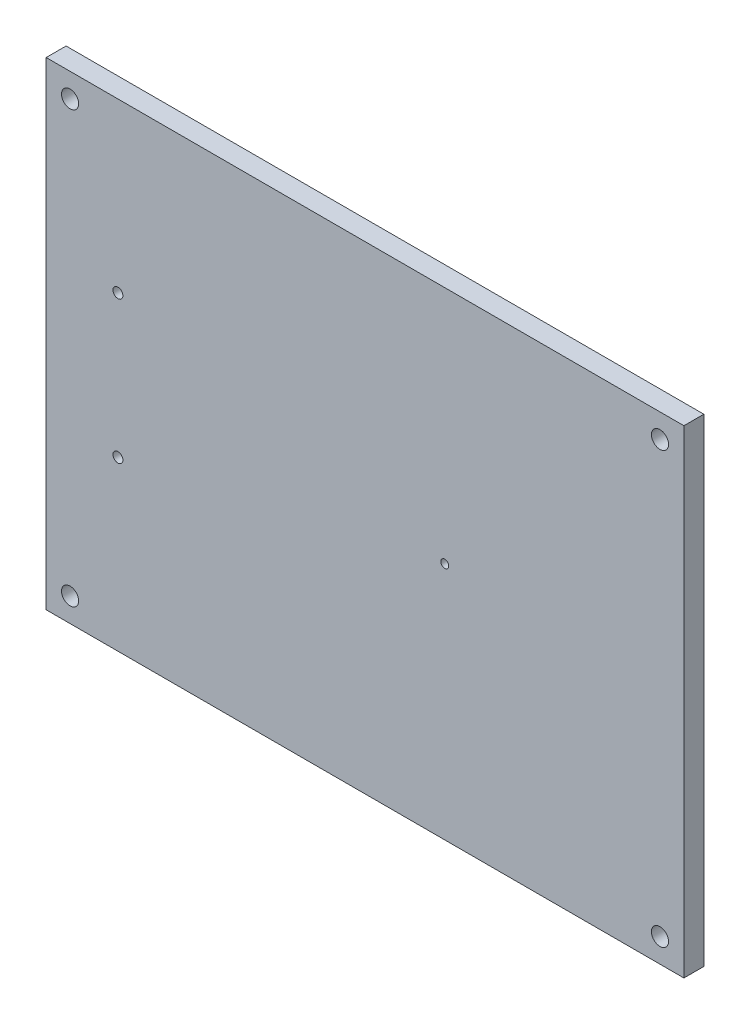
from build123d import *

# Parameters (mm, degrees)
SKETCH1_W           = 160
SKETCH1_H           = 120
SKETCH1_R           = 1
SKETCH1_R_2         = 1.25
SKETCH1_R_3         = 2.15
BOSS_EXTRUDE1_DEPTH = 5


with BuildPart() as part:
    # Sketch1 → Boss-Extrude1 (new body)
    with BuildSketch(Plane.XY):
        with Locations((70, 5)):
            Rectangle(SKETCH1_W, SKETCH1_H)
        with Locations((90, 5)):
            Circle(SKETCH1_R, mode=Mode.SUBTRACT)
        with Locations((8, -12.87)):
            Circle(SKETCH1_R_2, mode=Mode.SUBTRACT)
        with Locations((8, 22.87)):
            Circle(SKETCH1_R_2, mode=Mode.SUBTRACT)
        with Locations((-4, -49)):
            Circle(SKETCH1_R_3, mode=Mode.SUBTRACT)
        with Locations((144, -49)):
            Circle(SKETCH1_R_3, mode=Mode.SUBTRACT)
        with Locations((144, 59)):
            Circle(SKETCH1_R_3, mode=Mode.SUBTRACT)
        with Locations((-4, 59)):
            Circle(SKETCH1_R_3, mode=Mode.SUBTRACT)
    extrude(amount=BOSS_EXTRUDE1_DEPTH)


solid = part.part
